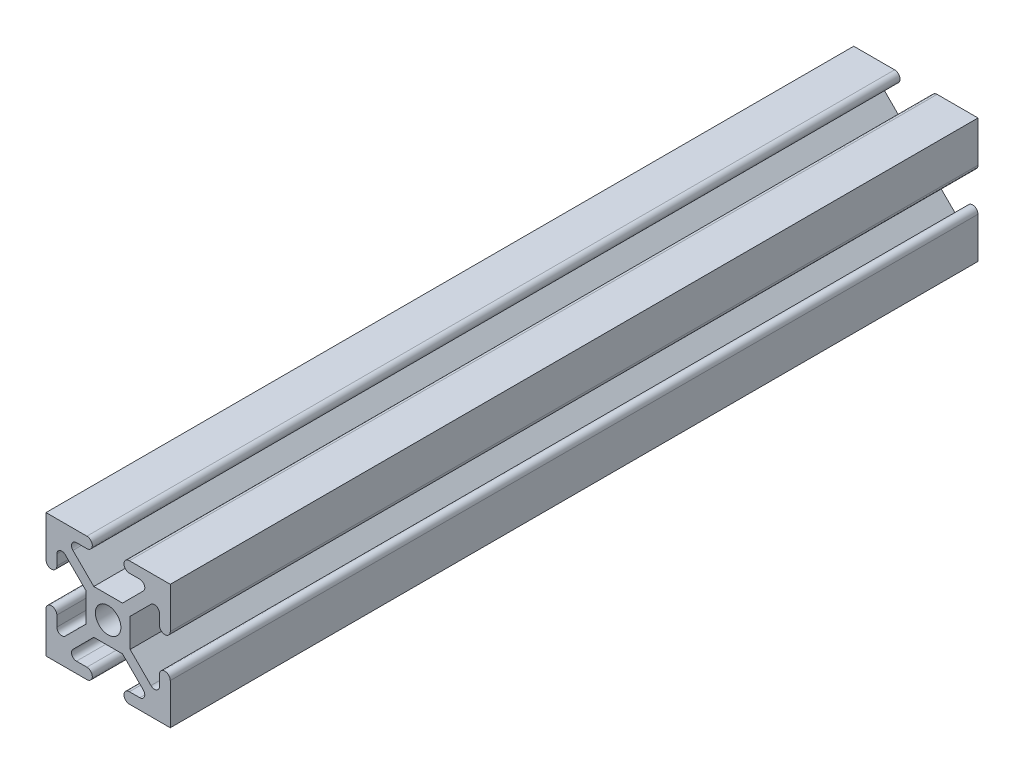
from build123d import *

# Parameters (mm, degrees)
SKETCH1_R           = 2.6035
BOSS_EXTRUDE1_DEPTH = 165.1


with BuildPart() as part:
    # Sketch1 → Boss-Extrude1 (new body)
    with BuildSketch(Plane.XY):
        with BuildLine():
            Line((-12.7, -12.7), (-4.343399971, -12.7))
            ThreePointArc((-4.343399971, -12.7), (-3.238499971, -11.5951), (-4.343399971, -10.4902))
            Line((-4.343399971, -10.4902), (-6.474794456, -10.4902))
            ThreePointArc((-6.474794456, -10.4902), (-7.413456061, -9.863006367), (-7.193214945, -8.75577951))
            Line((-7.193214945, -8.75577951), (-2.933235435, -4.4958))
            Line((-2.933235435, -4.4958), (2.933235435, -4.4958))
            Line((2.933235435, -4.4958), (7.193214945, -8.75577951))
            ThreePointArc((7.193214945, -8.75577951), (7.413456061, -9.863006367), (6.474794456, -10.4902))
            Line((6.474794456, -10.4902), (4.3434, -10.4902))
            ThreePointArc((4.3434, -10.4902), (3.2385, -11.5951), (4.3434, -12.7))
            Line((4.3434, -12.7), (12.7, -12.7))
            Line((12.7, -12.7), (12.7, -4.343399971))
            ThreePointArc((12.7, -4.343399971), (11.5951, -3.238499971), (10.4902, -4.343399971))
            Line((10.4902, -4.343399971), (10.4902, -6.474794456))
            ThreePointArc((10.4902, -6.474794456), (9.863006367, -7.413456061), (8.75577951, -7.193214945))
            Line((8.75577951, -7.193214945), (4.4958, -2.933235435))
            Line((4.4958, -2.933235435), (4.4958, 2.933235435))
            Line((4.4958, 2.933235435), (8.75577951, 7.193214945))
            ThreePointArc((8.75577951, 7.193214945), (9.863006367, 7.413456061), (10.4902, 6.474794456))
            Line((10.4902, 6.474794456), (10.4902, 4.3434))
            ThreePointArc((10.4902, 4.3434), (11.5951, 3.2385), (12.7, 4.3434))
            Line((12.7, 4.3434), (12.7, 12.7))
            Line((12.7, 12.7), (4.343399971, 12.7))
            ThreePointArc((4.343399971, 12.7), (3.238499971, 11.5951), (4.343399971, 10.4902))
            Line((4.343399971, 10.4902), (6.474794456, 10.4902))
            ThreePointArc((6.474794456, 10.4902), (7.413456061, 9.863006367), (7.193214945, 8.75577951))
            Line((7.193214945, 8.75577951), (2.933235435, 4.4958))
            Line((2.933235435, 4.4958), (-2.933235435, 4.4958))
            Line((-2.933235435, 4.4958), (-7.193214945, 8.75577951))
            ThreePointArc((-7.193214945, 8.75577951), (-7.413456061, 9.863006367), (-6.474794456, 10.4902))
            Line((-6.474794456, 10.4902), (-4.3434, 10.4902))
            ThreePointArc((-4.3434, 10.4902), (-3.2385, 11.5951), (-4.3434, 12.7))
            Line((-4.3434, 12.7), (-12.7, 12.7))
            Line((-12.7, 12.7), (-12.7, 4.343399971))
            ThreePointArc((-12.7, 4.343399971), (-11.5951, 3.238499971), (-10.4902, 4.343399971))
            Line((-10.4902, 4.343399971), (-10.4902, 6.474794456))
            ThreePointArc((-10.4902, 6.474794456), (-9.863006367, 7.413456061), (-8.75577951, 7.193214945))
            Line((-8.75577951, 7.193214945), (-4.4958, 2.933235435))
            Line((-4.4958, 2.933235435), (-4.4958, -2.933235435))
            Line((-4.4958, -2.933235435), (-8.75577951, -7.193214945))
            ThreePointArc((-8.75577951, -7.193214945), (-9.863006367, -7.413456061), (-10.4902, -6.474794456))
            Line((-10.4902, -6.474794456), (-10.4902, -4.3434))
            ThreePointArc((-10.4902, -4.3434), (-11.5951, -3.2385), (-12.7, -4.3434))
            Line((-12.7, -4.3434), (-12.7, -12.7))
        make_face()
        with Locations(Location((0, 0, 0), (0, 0, 180))):
            Circle(SKETCH1_R, mode=Mode.SUBTRACT)
    extrude(amount=-BOSS_EXTRUDE1_DEPTH)


solid = part.part
